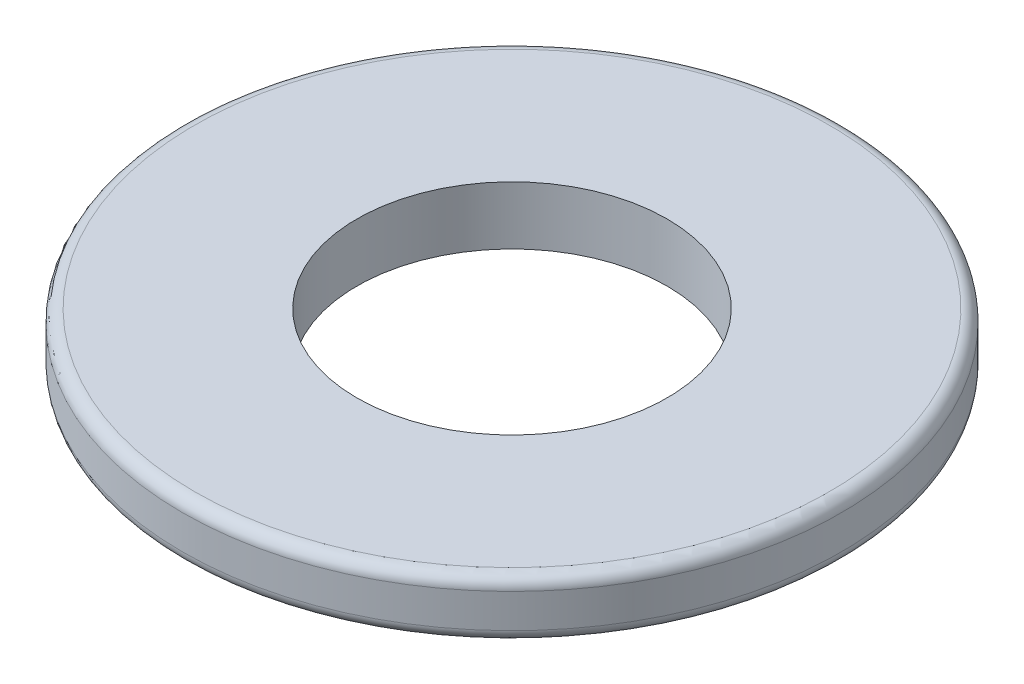
from build123d import *

# Parameters (mm, degrees)
SKETCH1_R           = 3.4
SKETCH1_R_2         = 1.6
BOSS_EXTRUDE1_DEPTH = 0.6
FILLET1_R           = 0.125


with BuildPart() as part:
    # Sketch1 → Boss-Extrude1 (new body)
    with BuildSketch(Plane(origin=(0, 0, 0), x_dir=(1, 0, 0), z_dir=(0, 1, 0))):
        with Locations(Location((0, 0, 0), (0, 0, 270))):
            Circle(SKETCH1_R)
        with Locations(Location((0, 0, 0), (0, 0, 270))):
            Circle(SKETCH1_R_2, mode=Mode.SUBTRACT)
    extrude(amount=BOSS_EXTRUDE1_DEPTH)

    # Fillet1
    fillet1_edges = [part.edges().sort_by_distance(p)[0] for p in [
        (0, 0, -3.4),
        (0, 0.6, -3.4),
    ]]
    fillet(fillet1_edges, radius=FILLET1_R)


solid = part.part
